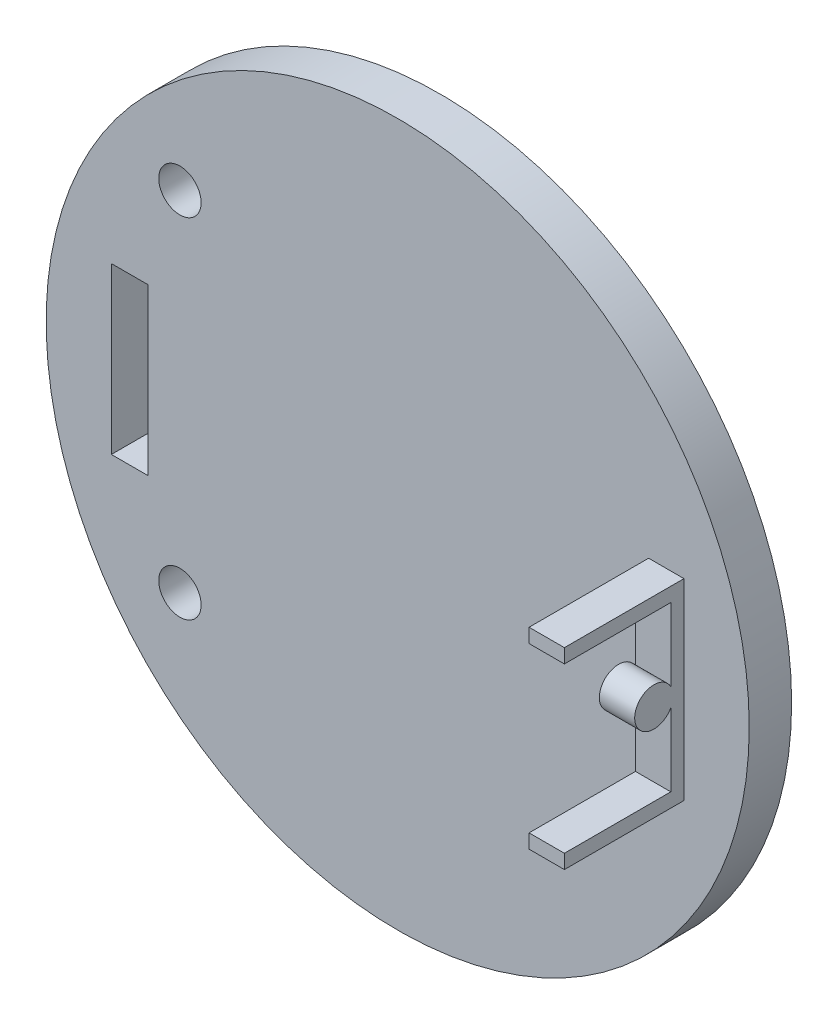
from build123d import *

# Parameters (mm, degrees)
SKETCH1_R           = 24.875
BOSS_EXTRUDE2_DEPTH = 3
SKETCH1_4_W         = 2.5
SKETCH1_4_H         = 13.6
BOSS_EXTRUDE3_DEPTH = 8.46
CUT_EXTRUDE1_DEPTH  = 2.5
SKETCH10_R          = 1.5
CUT_EXTRUDE3_DEPTH  = 4.95
SKETCH5_W           = 2.6
SKETCH5_H           = 11.7
CUT_EXTRUDE4_DEPTH  = 4.95


with BuildPart() as part:
    # Sketch1 → Boss-Extrude2 (new body)
    with BuildSketch(Plane.XY):
        Circle(SKETCH1_R)
    extrude(amount=-BOSS_EXTRUDE2_DEPTH)

    # Sketch1<4> → Boss-Extrude3 (add)
    with BuildSketch(Plane.XY):
        with Locations((19.005, 0)):
            Rectangle(SKETCH1_4_W, SKETCH1_4_H)
    extrude(amount=BOSS_EXTRUDE3_DEPTH)

    # Sketch4 → Cut-Extrude1 (cut)
    with BuildSketch(Plane(origin=(20.255, 0, 0), x_dir=(0, 0, -1), z_dir=(1, 0, 0))):
        with BuildLine():
            ThreePointArc((-0.931303911, -0.65), (-3.48591682, 0), (-0.931303911, 0.65))
            Line((-0.931303911, 0.65), (-0.931303911, 5.8))
            Line((-0.931303911, 5.8), (-8.46, 5.8))
            Line((-8.46, 5.8), (-8.46, -5.8))
            Line((-8.46, -5.8), (-0.931303911, -5.8))
            Line((-0.931303911, -5.8), (-0.931303911, -0.65))
        make_face()
    extrude(amount=-CUT_EXTRUDE1_DEPTH, mode=Mode.SUBTRACT)

    # Sketch10 → Cut-Extrude3 (cut)
    with BuildSketch(Plane.XY):
        with Locations((-15.409206931, 12.75144494)):
            Circle(SKETCH10_R)
        with Locations((-15.409206931, -11.899319199)):
            Circle(SKETCH10_R)
    extrude(amount=-CUT_EXTRUDE3_DEPTH, mode=Mode.SUBTRACT)

    # Sketch5 → Cut-Extrude4 (cut)
    with BuildSketch(Plane.XY):
        with Locations((-18.96, 0)):
            Rectangle(SKETCH5_W, SKETCH5_H)
    extrude(amount=-CUT_EXTRUDE4_DEPTH, mode=Mode.SUBTRACT)


solid = part.part
